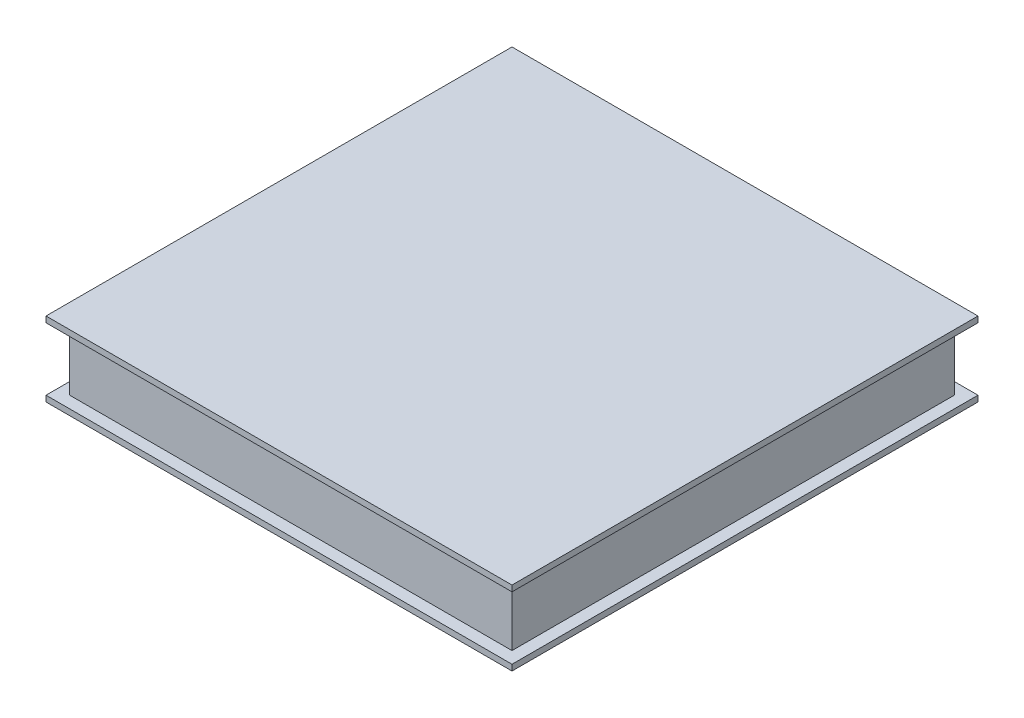
from build123d import *

# Parameters (mm, degrees)
SKETCH1_W           = 10.0076
SKETCH1_H           = 10.0076
SKETCH1_W_2         = 9.4996
SKETCH1_H_2         = 9.4996
BOSS_EXTRUDE1_DEPTH = 0.127
SKETCH2_W           = 9.4996
SKETCH2_H           = 9.4996
BOSS_EXTRUDE2_DEPTH = 1.6002
SKETCH3_W           = 10.0076
SKETCH3_H           = 10.0076
SKETCH3_W_2         = 9.4996
SKETCH3_H_2         = 9.4996
BOSS_EXTRUDE3_DEPTH = 0.127


with BuildPart() as part:
    # Sketch1 → Boss-Extrude1 (new body)
    with BuildSketch(Plane(origin=(0, 0, 0), x_dir=(1, 0, 0), z_dir=(0, 1, 0))):
        with Locations((-0.7855503, 0.539979905)):
            Rectangle(SKETCH1_W, SKETCH1_H)
        with Locations((-0.7855503, 0.539979905)):
            Rectangle(SKETCH1_W_2, SKETCH1_H_2, mode=Mode.SUBTRACT)
    extrude(amount=BOSS_EXTRUDE1_DEPTH)

    # Sketch2 → Boss-Extrude2 (add)
    with BuildSketch(Plane(origin=(0, 0, 0), x_dir=(-1, 0, 0), z_dir=(0, -1, 0))):
        with Locations((0.7855503, 0.539979905)):
            Rectangle(SKETCH2_W, SKETCH2_H)
    extrude(amount=-BOSS_EXTRUDE2_DEPTH)

    # Sketch3 → Boss-Extrude3 (add)
    with BuildSketch(Plane(origin=(0, 1.6002, 0), x_dir=(1, 0, 0), z_dir=(0, 1, 0))):
        with Locations((-0.7855503, 0.539979905)):
            Rectangle(SKETCH3_W, SKETCH3_H)
        with Locations((-0.7855503, 0.539979905)):
            Rectangle(SKETCH3_W_2, SKETCH3_H_2, mode=Mode.SUBTRACT)
    extrude(amount=-BOSS_EXTRUDE3_DEPTH)


solid = part.part
